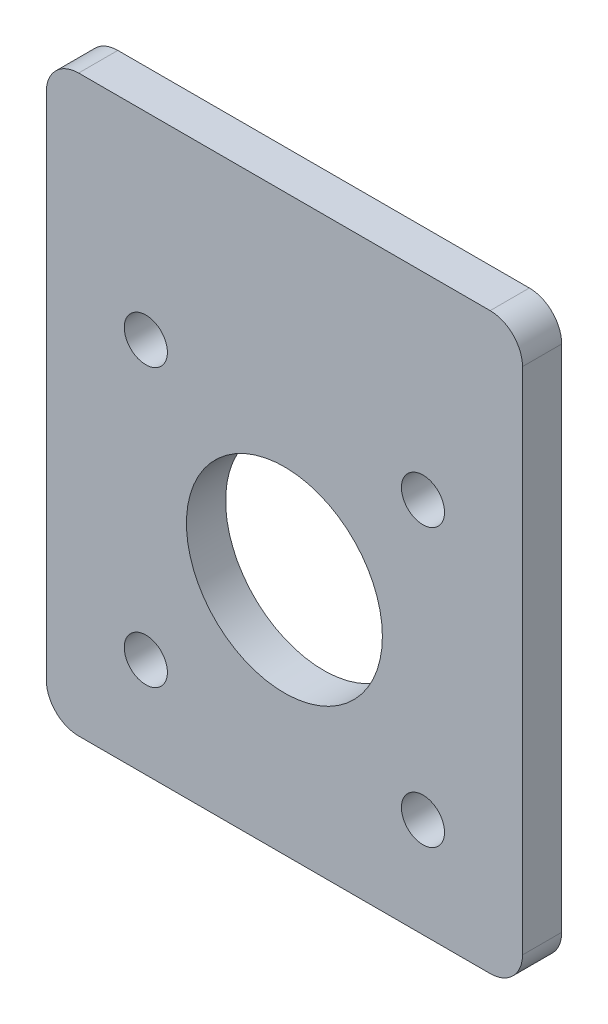
from build123d import *

# Parameters (mm, degrees)
CROQUIS1_R              = 5
CROQUIS1_R_2            = 1.1
SALIENTE_EXTRUIR1_DEPTH = 2
CORTAR_EXTRUIR1_START   = -2
CORTAR_EXTRUIR1_DEPTH   = 2


with BuildPart() as part:
    # Croquis1 → Saliente-Extruir1 (new body)
    with BuildSketch(Plane.XY):
        with BuildLine():
            Line((-18.543218985, 4.011674701), (-18.543218985, -21.988325299))
            ThreePointArc((-18.543218985, -21.988325299), (-17.957432547, -23.402538861), (-16.543218985, -23.988325299))
            Line((-16.543218985, -23.988325299), (4.456781015, -23.988325299))
            ThreePointArc((4.456781015, -23.988325299), (5.870994578, -23.402538861), (6.456781015, -21.988325299))
            Line((6.456781015, -21.988325299), (6.456781015, 4.011674701))
            ThreePointArc((6.456781015, 4.011674701), (5.870994578, 5.425888264), (4.456781015, 6.011674701))
            Line((4.456781015, 6.011674701), (-16.543218985, 6.011674701))
            ThreePointArc((-16.543218985, 6.011674701), (-17.957432547, 5.425888264), (-18.543218985, 4.011674701))
        make_face()
        with Locations((-6.043218985, -11.488325299)):
            Circle(CROQUIS1_R, mode=Mode.SUBTRACT)
        with Locations((-13.114286796, -4.417257487)):
            Circle(CROQUIS1_R_2, mode=Mode.SUBTRACT)
        with Locations((1.027848827, -4.417257487)):
            Circle(CROQUIS1_R_2, mode=Mode.SUBTRACT)
        with Locations((-13.114286796, -18.559393111)):
            Circle(CROQUIS1_R_2, mode=Mode.SUBTRACT)
        with Locations((1.027848827, -18.559393111)):
            Circle(CROQUIS1_R_2, mode=Mode.SUBTRACT)
    extrude(amount=SALIENTE_EXTRUIR1_DEPTH)

    # Croquis2 → Cortar-Extruir1 (cut)
    with BuildSketch(Plane.XY.offset(2).offset(CORTAR_EXTRUIR1_START)):
        with BuildLine():
            Line((4.456781015, 6.011674701), (-16.543218985, 6.011674701))
            ThreePointArc((-16.543218985, 6.011674701), (-17.957432547, 5.425888264), (-18.543218985, 4.011674701))
            Line((-18.543218985, 4.011674701), (-18.543218985, -21.988325299))
            ThreePointArc((-18.543218985, -21.988325299), (-17.957432547, -23.402538861), (-16.543218985, -23.988325299))
            Line((-16.543218985, -23.988325299), (4.456781015, -23.988325299))
            ThreePointArc((4.456781015, -23.988325299), (5.870994578, -23.402538861), (6.456781015, -21.988325299))
            Line((6.456781015, -21.988325299), (6.456781015, 4.011674701))
            ThreePointArc((6.456781015, 4.011674701), (5.870994578, 5.425888264), (4.456781015, 6.011674701))
        make_face()
        with BuildLine():
            Line((-18.193218985, 4.011674701), (-18.193218985, -21.988325299))
            ThreePointArc((-18.193218985, -21.988325299), (-17.709945174, -23.155051488), (-16.543218985, -23.638325299))
            Line((-16.543218985, -23.638325299), (4.456781015, -23.638325299))
            ThreePointArc((4.456781015, -23.638325299), (5.623507204, -23.155051488), (6.106781015, -21.988325299))
            Line((6.106781015, -21.988325299), (6.106781015, 4.011674701))
            ThreePointArc((6.106781015, 4.011674701), (5.623507204, 5.17840089), (4.456781015, 5.661674701))
            Line((4.456781015, 5.661674701), (-16.543218985, 5.661674701))
            ThreePointArc((-16.543218985, 5.661674701), (-17.709945174, 5.17840089), (-18.193218985, 4.011674701))
        make_face(mode=Mode.SUBTRACT)
    extrude(amount=CORTAR_EXTRUIR1_DEPTH, mode=Mode.SUBTRACT)


solid = part.part
